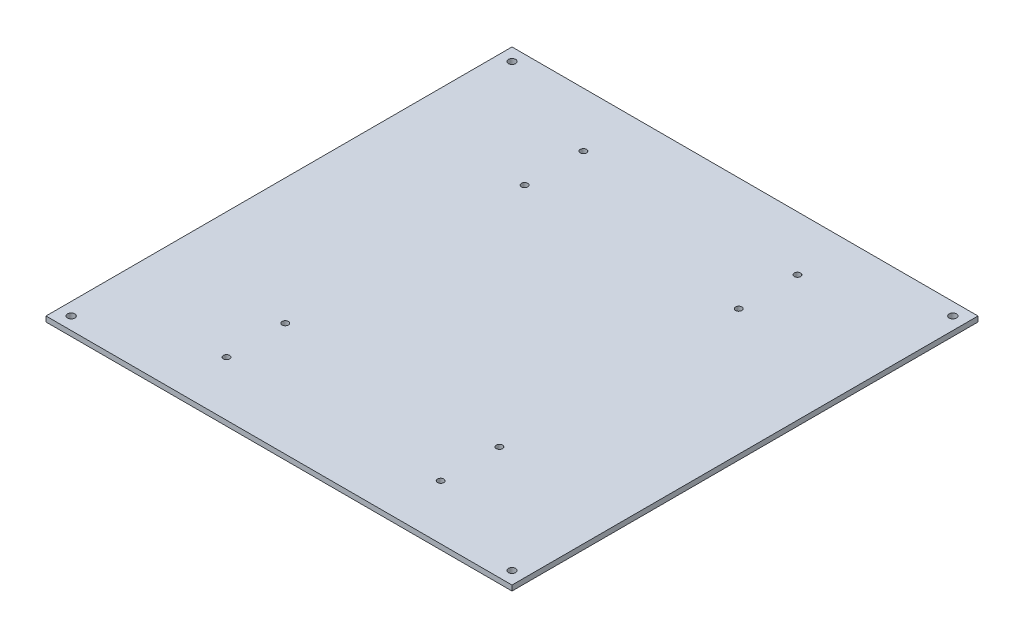
from build123d import *

# Parameters (mm, degrees)
SKETCH_1_W          = 222
SKETCH_1_H          = 222
SKETCH_1_R          = 1.75
EXTRUDE_1_DEPTH     = 2.5
SKETCH_2_R          = 1.5
CUT_EXTRUDE_1_DEPTH = 314.965364332


with BuildPart() as part:
    # 草图1 → 凸台-拉伸1 (new body)
    with BuildSketch(Plane(origin=(0, 0, 0), x_dir=(1, 0, 0), z_dir=(0, 1, 0))):
        with Locations((111, 111)):
            Rectangle(SKETCH_1_W, SKETCH_1_H)
        with Locations(Location((6, 6, 0), (0, 0, 270))):
            Circle(SKETCH_1_R, mode=Mode.SUBTRACT)
        with Locations(Location((216, 6, 0), (0, 0, 270))):
            Circle(SKETCH_1_R, mode=Mode.SUBTRACT)
        with Locations(Location((216, 216, 0), (0, 0, 270))):
            Circle(SKETCH_1_R, mode=Mode.SUBTRACT)
        with Locations(Location((6, 216, 0), (0, 0, 270))):
            Circle(SKETCH_1_R, mode=Mode.SUBTRACT)
    extrude(amount=EXTRUDE_1_DEPTH)

    # 草图2 → 切除-拉伸1 (cut, through all)
    with BuildSketch(Plane.XZ):
        with Locations(Location((60, -26, 0), (0, 0, 270))):
            Circle(SKETCH_2_R)
        with Locations(Location((60, -54, 0), (0, 0, 270))):
            Circle(SKETCH_2_R)
        with Locations(Location((60, -168, 0), (0, 0, 90))):
            Circle(SKETCH_2_R)
        with Locations(Location((60, -196, 0), (0, 0, 90))):
            Circle(SKETCH_2_R)
        with Locations(Location((162, -196, 0), (0, 0, 270))):
            Circle(SKETCH_2_R)
        with Locations(Location((162, -168, 0), (0, 0, 270))):
            Circle(SKETCH_2_R)
        with Locations(Location((162, -54, 0), (0, 0, 90))):
            Circle(SKETCH_2_R)
        with Locations(Location((162, -26, 0), (0, 0, 90))):
            Circle(SKETCH_2_R)
    extrude(amount=-CUT_EXTRUDE_1_DEPTH, mode=Mode.SUBTRACT)


solid = part.part
